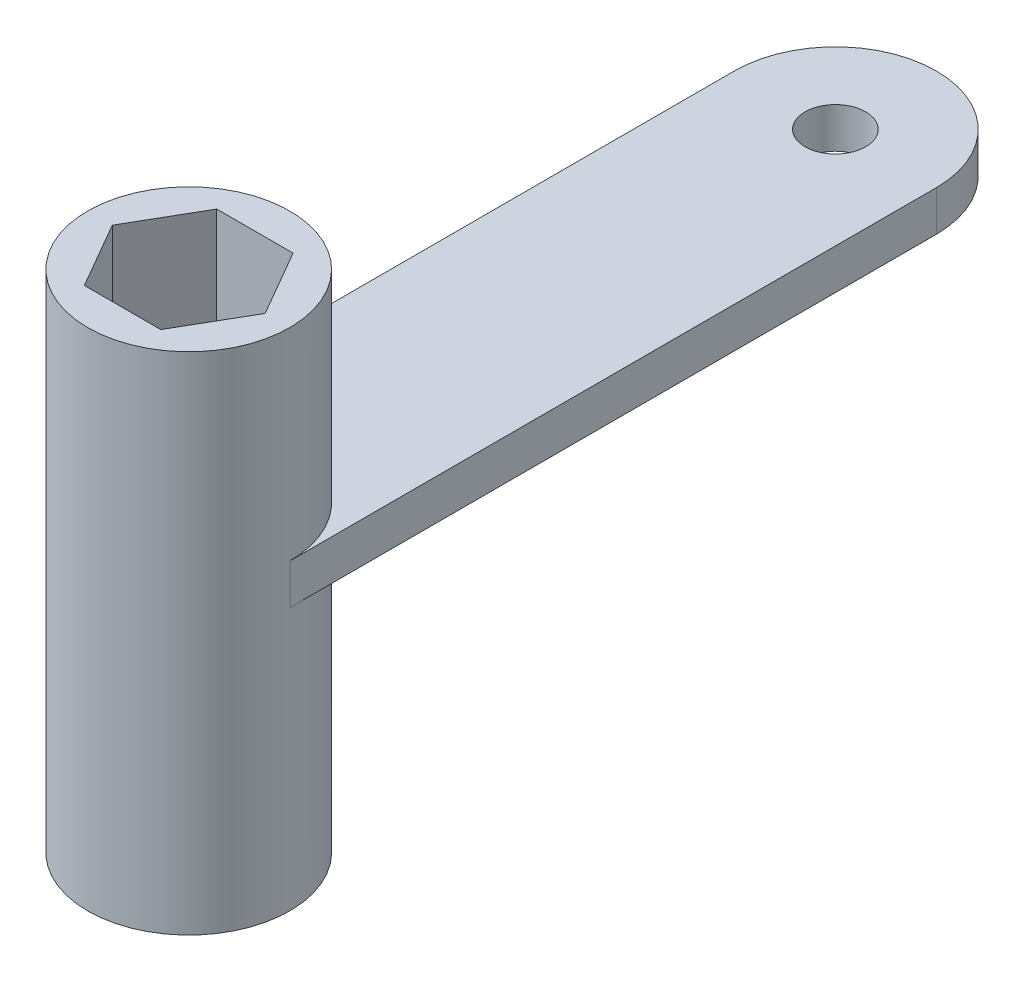
from build123d import *

# Parameters (mm, degrees)
SKETCH_1_R      = 1.5
EXTRUDE_1_DEPTH = 2
SKETCH_2_R      = 5
EXTRUDE_2_DEPTH = 10
EXTRUDE_START   = -25
SKETCH_4_R      = 5
EXTRUDE_3_DEPTH = 25
EXTRUDE_4_DEPTH = 7.8
EXTRUDE_START_2 = -7.8
SKETCH_6_R      = 1.6
EXTRUDE_5_DEPTH = 5


with BuildPart() as part:
    # 草图1 → 凸台-拉伸1 (new body)
    with BuildSketch(Plane(origin=(0, 0, 0), x_dir=(1, 0, 0), z_dir=(0, 1, 0))):
        with BuildLine():
            Line((-5, -16), (-5, 16))
            ThreePointArc((-5, 16), (0, 21), (5, 16))
            Line((5, 16), (5, -16))
            ThreePointArc((5, -16), (0, -21), (-5, -16))
        make_face()
        with Locations(Location((0, 16, 0), (0, 0, 270))):
            Circle(SKETCH_1_R, mode=Mode.SUBTRACT)
        Polygon((1.890822132, -12.725), (-1.890822132, -12.725), (-3.781644263, -16), (-1.890822132, -19.275), (1.890822132, -19.275), (3.781644263, -16), align=None, mode=Mode.SUBTRACT)
    extrude(amount=EXTRUDE_1_DEPTH)

    # 草图2 → 凸台-拉伸2 (add)
    with BuildSketch(Plane(origin=(0, 2, 0), x_dir=(1, 0, 0), z_dir=(0, 1, 0))):
        with Locations((0, -16)):
            Circle(SKETCH_2_R)
        Polygon((3.781644263, -16), (1.890822132, -12.725), (-1.890822132, -12.725), (-3.781644263, -16), (-1.890822132, -19.275), (1.890822132, -19.275), align=None, mode=Mode.SUBTRACT)
    extrude(amount=EXTRUDE_2_DEPTH)

    # 草图4 → 凸台-拉伸3 (add)
    with BuildSketch(Plane(origin=(0, 12, 0), x_dir=(1, 0, 0), z_dir=(0, 1, 0)).offset(EXTRUDE_START)):
        with Locations(Location((0, -16, 0), (0, 0, 270))):
            Circle(SKETCH_4_R)
        Polygon((-1.890822132, -12.725), (1.890822132, -12.725), (3.781644263, -16), (1.890822132, -19.275), (-1.890822132, -19.275), (-3.781644263, -16), align=None, mode=Mode.SUBTRACT)
    extrude(amount=EXTRUDE_3_DEPTH)

    # 草图5 → 凸台-拉伸4 (add)
    with BuildSketch(Plane.XZ.offset(13)):
        Polygon((1.890822132, 12.725), (-1.890822132, 12.725), (-3.781644263, 16), (-1.890822132, 19.275), (1.890822132, 19.275), (3.781644263, 16), align=None)
    extrude(amount=-EXTRUDE_4_DEPTH)

    # 草图6 → 凸台-拉伸5 (add)
    with BuildSketch(Plane.XZ.offset(13).offset(EXTRUDE_START_2)):
        with Locations(Location((0, 16, 0), (0, 0, 270))):
            Circle(SKETCH_6_R)
    extrude(amount=-EXTRUDE_5_DEPTH)


solid = part.part
